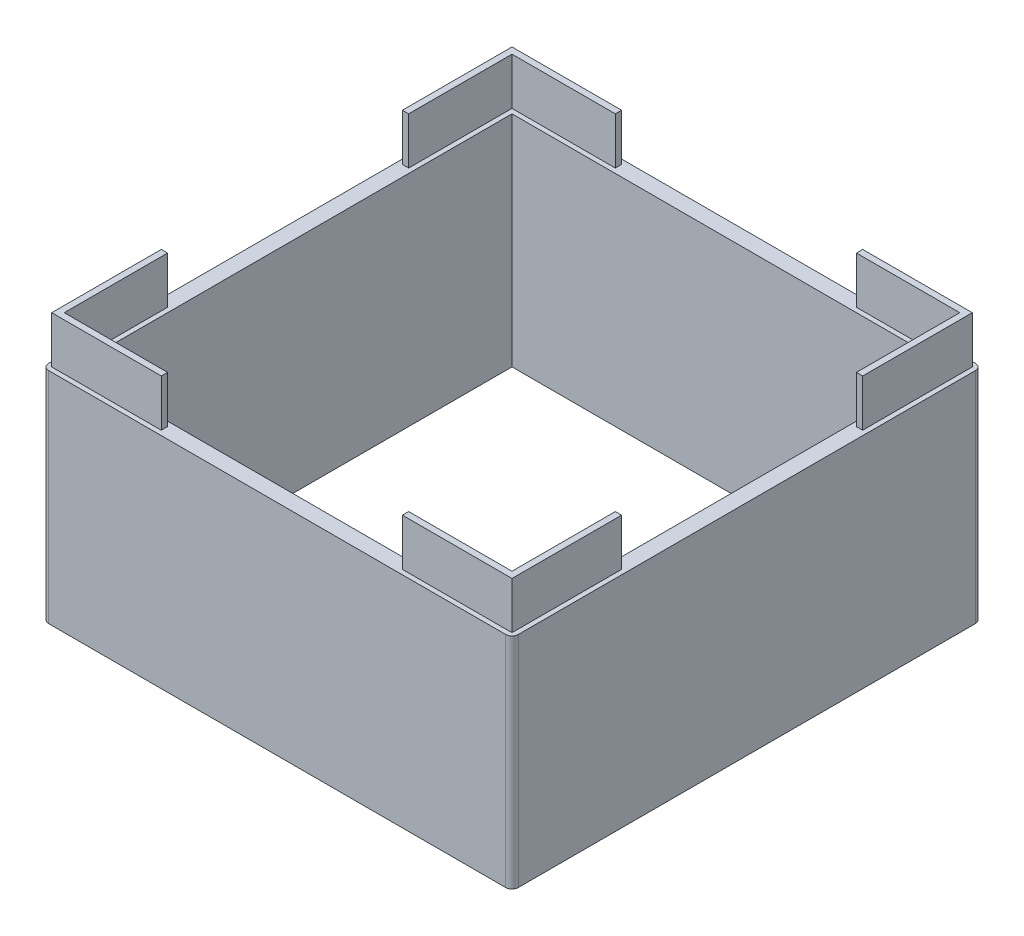
from build123d import *

# Parameters (mm, degrees)
SKETCH1_W           = 150
SKETCH1_H           = 150
SKETCH1_W_2         = 140
SKETCH1_H_2         = 140
BOSS_EXTRUDE1_DEPTH = 70
BOSS_EXTRUDE2_DEPTH = 15
CUT_EXTRUDE1_DEPTH  = 25
FILLET1_R           = 2


with BuildPart() as part:
    # Sketch1 → Boss-Extrude1 (new body)
    with BuildSketch(Plane(origin=(0, 0, 0), x_dir=(1, 0, 0), z_dir=(0, 1, 0))):
        with Locations((70, 70)):
            Rectangle(SKETCH1_W, SKETCH1_H)
        with Locations((70, 70)):
            Rectangle(SKETCH1_W_2, SKETCH1_H_2, mode=Mode.SUBTRACT)
    extrude(amount=BOSS_EXTRUDE1_DEPTH)

    # Sketch2 → Boss-Extrude2 (add)
    with BuildSketch(Plane(origin=(0, 70, 0), x_dir=(1, 0, 0), z_dir=(0, 1, 0))):
        Polygon((-3.5, 108.5), (-3.5, 143.5), (31.5, 143.5), (31.5, 141.5), (-1.5, 141.5), (-1.5, 108.5), align=None)
        Polygon((143.5, 108.5), (143.5, 143.5), (108.5, 143.5), (108.5, 141.5), (141.5, 141.5), (141.5, 108.5), align=None)
        Polygon((143.5, 31.5), (143.5, -3.5), (108.5, -3.5), (108.5, -1.5), (141.5, -1.5), (141.5, 31.5), align=None)
        Polygon((-3.5, 31.5), (-3.5, -3.5), (31.5, -3.5), (31.5, -1.5), (-1.5, -1.5), (-1.5, 31.5), align=None)
    extrude(amount=BOSS_EXTRUDE2_DEPTH)

    # Sketch3 → Cut-Extrude1 (cut)
    with BuildSketch(Plane.XZ):
        Polygon((-3.65, 3.65), (31.55, 3.65), (31.55, 1.35), (-1.35, 1.35), (-1.35, -31.55), (-3.65, -31.55), align=None)
        Polygon((143.65, -31.55), (143.65, 3.65), (108.45, 3.65), (108.45, 1.35), (141.35, 1.35), (141.35, -31.55), align=None)
        Polygon((143.65, -143.65), (108.45, -143.65), (108.45, -141.35), (141.35, -141.35), (141.35, -108.45), (143.65, -108.45), align=None)
        Polygon((-3.65, -108.45), (-3.65, -143.65), (31.55, -143.65), (31.55, -141.35), (-1.35, -141.35), (-1.35, -108.45), align=None)
    extrude(amount=-CUT_EXTRUDE1_DEPTH, mode=Mode.SUBTRACT)

    # Fillet1
    fillet1_edges = [part.edges().sort_by_distance(p)[0] for p in [
        (-5, 35, 5),
        (-5, 35, -145),
        (145, 35, -145),
        (145, 35, 5),
    ]]
    fillet(fillet1_edges, radius=FILLET1_R)


solid = part.part
